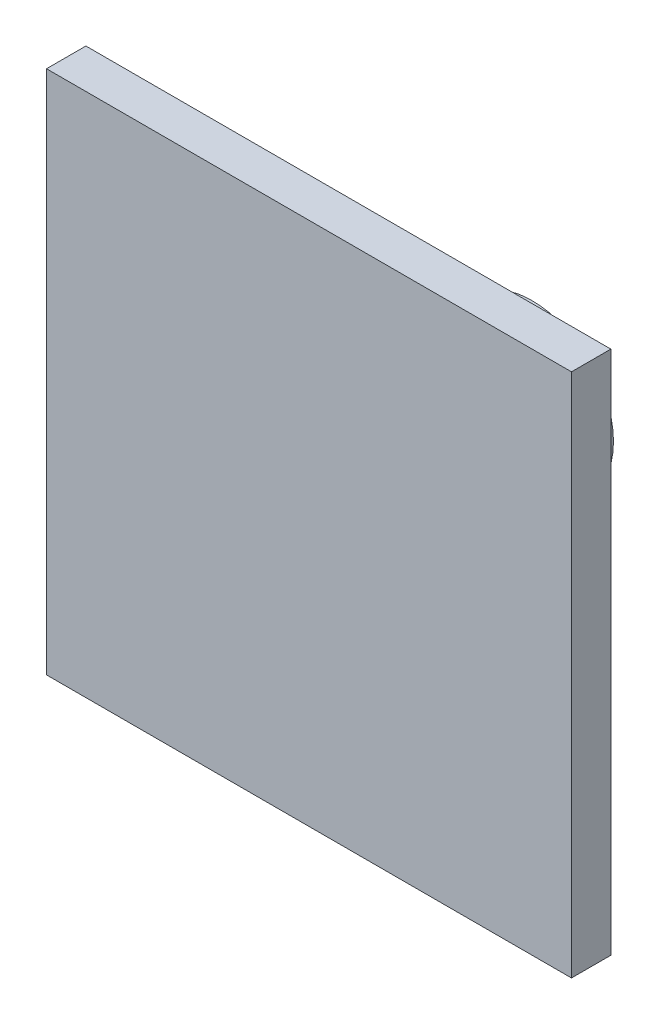
from build123d import *

# Parameters (mm, degrees)
SKETCH_2_W        = 20
SKETCH_2_H        = 20
EXTRUDE_348_DEPTH = 1.5
SKETCH_3_R        = 3.1
SKETCH_3_R_2      = 1.1
EXTRUDE_476_DEPTH = 7


with BuildPart() as part:
    # Эскиз2 → Extrude 348 (new body)
    with BuildSketch(Plane.XY):
        Rectangle(SKETCH_2_W, SKETCH_2_H)
    extrude(amount=EXTRUDE_348_DEPTH)

    # Эскиз3 → Extrude 476 (add)
    with BuildSketch(Plane.XY):
        Circle(SKETCH_3_R)
        Circle(SKETCH_3_R_2, mode=Mode.SUBTRACT)
    extrude(amount=-EXTRUDE_476_DEPTH)


solid = part.part
